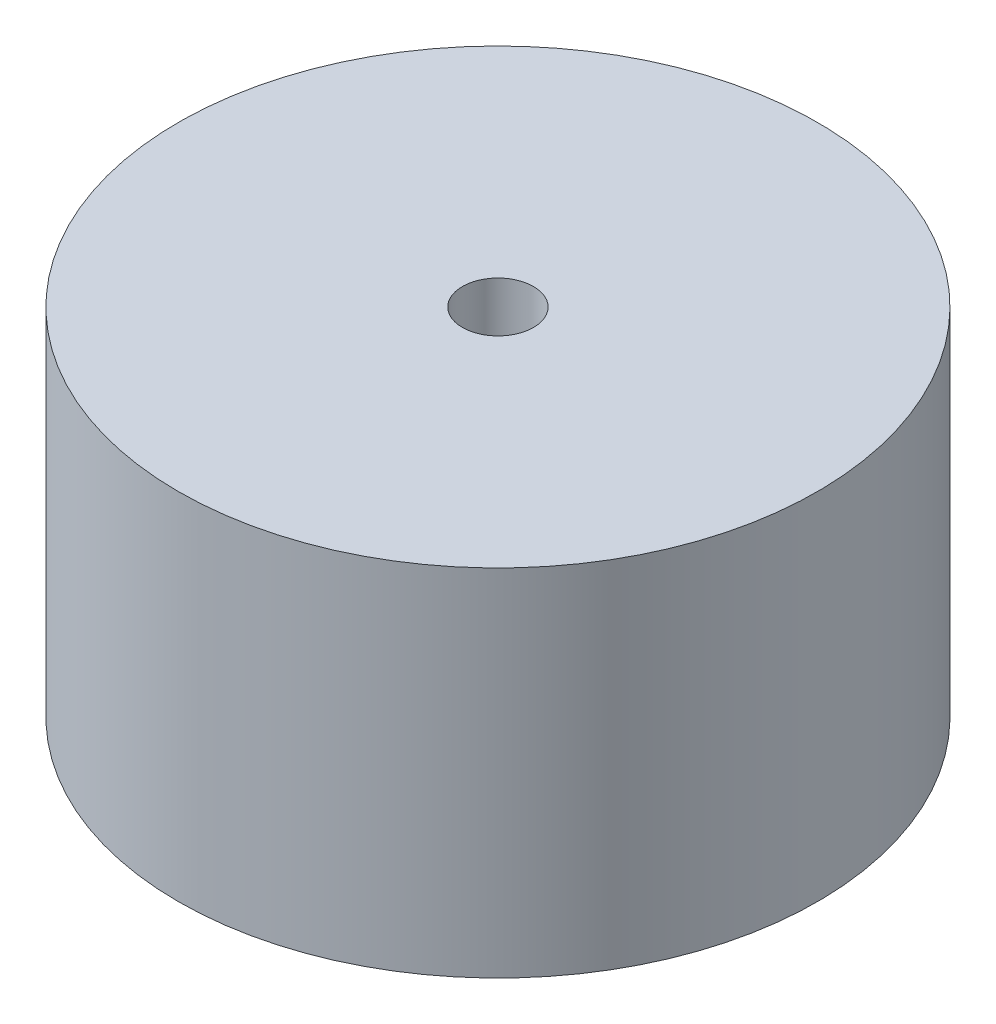
from build123d import *

# Parameters (mm, degrees)
SKETCH1_R           = 4.5
SKETCH1_R_2         = 0.5
BOSS_EXTRUDE1_DEPTH = 5


with BuildPart() as part:
    # Sketch1 → Boss-Extrude1 (new body)
    with BuildSketch(Plane(origin=(0, 0, 0), x_dir=(1, 0, 0), z_dir=(0, 1, 0))):
        with Locations(Location((0, 0, 0), (0, 0, 270))):
            Circle(SKETCH1_R)
        with Locations(Location((0, 0, 0), (0, 0, 270))):
            Circle(SKETCH1_R_2, mode=Mode.SUBTRACT)
    extrude(amount=BOSS_EXTRUDE1_DEPTH)


solid = part.part
